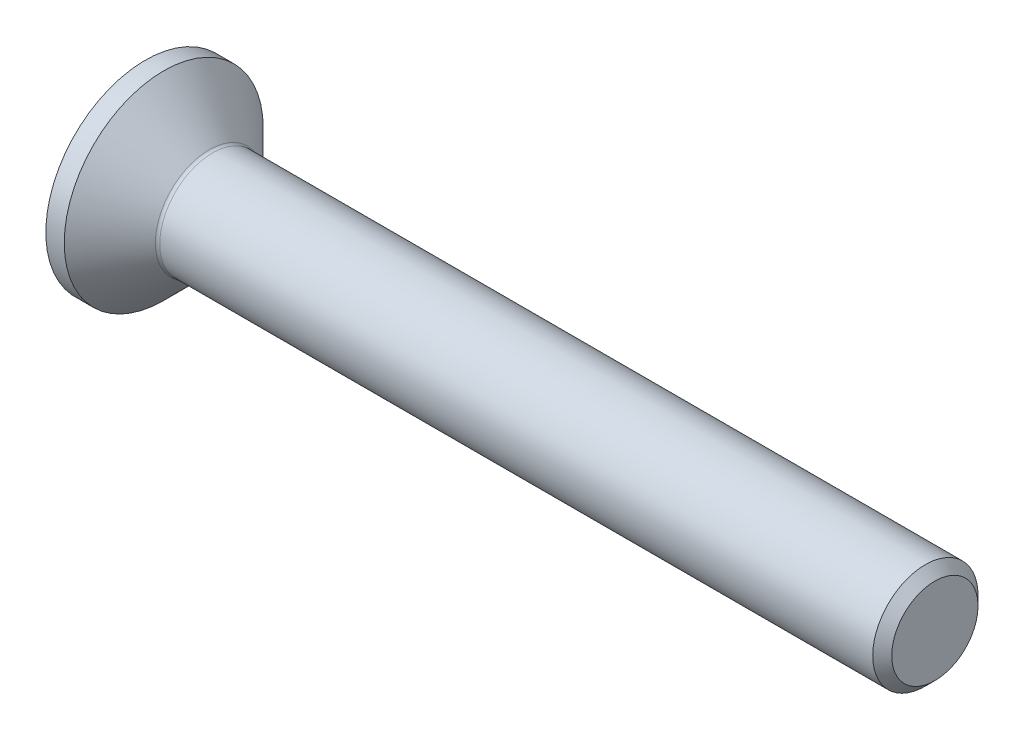
from build123d import *

# Parameters (mm, degrees)
HEXAGONSOCKET_DEPTH = 2.2
HEADFILLET_R        = 0.25
CHAMFER_2_SIZE      = 0.5415
SKETCH4_W           = 5
SKETCH4_H           = 5


with BuildPart() as part:
    # Sketch1 → Base (revolve)
    with BuildSketch(Plane.XY, mode=Mode.PRIVATE) as base_sk:
        Polygon((0, 0), (0, 6.72), (3.72, 3), (45, 3), (45, 0), align=None)
    revolve(base_sk.sketch.rotate(Axis((-0.587069181, 0, 0), (1, 0, 0)), 90), axis=Axis((-0.587069181, 0, 0), (1, 0, 0)))

    # Sketch2 → HexagonSocket (cut)
    with BuildSketch(Plane(origin=(0, 0, 0), x_dir=(0, 0, -1), z_dir=(1, 0, 0))):
        Polygon((2.309401077, 0), (1.154700538, 2), (-1.154700538, 2), (-2.309401077, 0), (-1.154700538, -2), (1.154700538, -2), align=None)
    extrude(amount=HEXAGONSOCKET_DEPTH, mode=Mode.SUBTRACT)

    # Sketch3 → Cut-Revolve1 (revolve, cut)
    with BuildSketch(Plane.XY, mode=Mode.PRIVATE) as cut_revolve1_sk:
        Polygon((2.2, 2), (3.354700538, 0), (2.2, 0), align=None)
    revolve(cut_revolve1_sk.sketch.rotate(Axis((-0.439109555, 0, 0), (1, 0, 0)), 90), axis=Axis((-0.439109555, 0, 0), (1, 0, 0)), mode=Mode.SUBTRACT)

    # HeadFillet
    headfillet_edges = [part.edges().sort_by_distance(p)[0] for p in [
        (3.72, 0, -3),
    ]]
    fillet(headfillet_edges, radius=HEADFILLET_R)

    # Chamfer 2
    chamfer_2_edges = [part.edges().sort_by_distance(p)[0] for p in [
        (45, 0, -3),
    ]]
    chamfer(chamfer_2_edges, length=CHAMFER_2_SIZE)

    # Sketch4 → Cut-Revolve2 (revolve, cut)
    with BuildSketch(Plane(origin=(0, 0, 0), x_dir=(1, 0, 0), z_dir=(0, 1, 0)), mode=Mode.PRIVATE) as cut_revolve2_sk:
        with Locations((0.5, 8.17)):
            Rectangle(SKETCH4_W, SKETCH4_H)
    revolve(cut_revolve2_sk.sketch.rotate(Axis((11.853138686, 0, 0), (-1, 0, 0)), 180), axis=Axis((11.853138686, 0, 0), (-1, 0, 0)), mode=Mode.SUBTRACT)


solid = part.part
